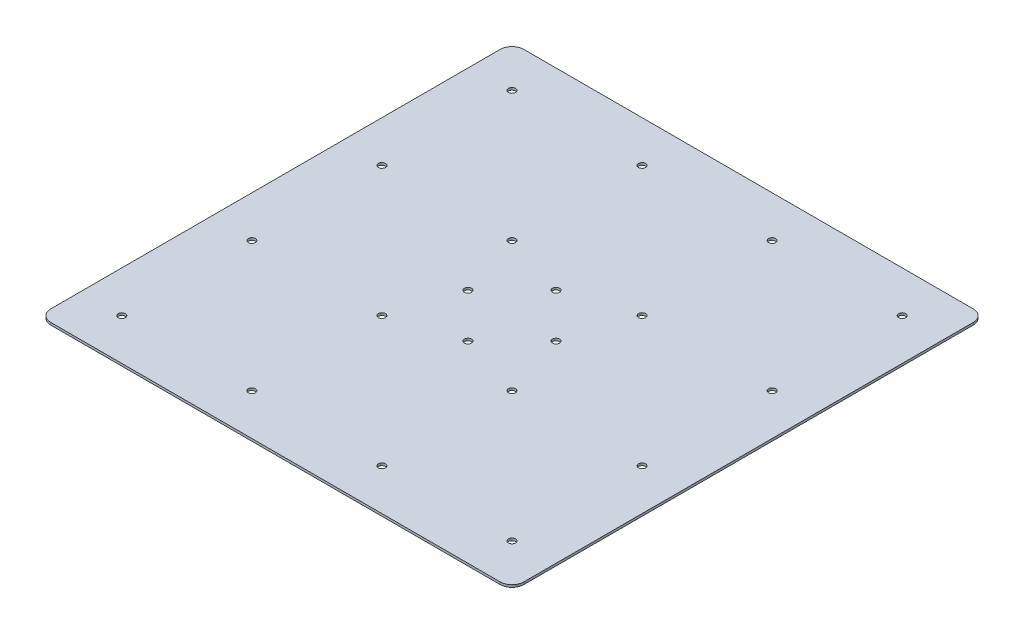
from build123d import *

# Parameters (mm, degrees)
SKETCH1_W           = 400
SKETCH1_H           = 400
BOSS_EXTRUDE1_DEPTH = 2
SKETCH3_R           = 3
CUT_EXTRUDE1_DEPTH  = 283.849783454
SKETCH4_R           = 3
CUT_EXTRUDE2_DEPTH  = 283.849783454
FILLET1_R           = 10


with BuildPart() as part:
    # Sketch1 → Boss-Extrude1 (new body)
    with BuildSketch(Plane(origin=(0, 0, 0), x_dir=(1, 0, 0), z_dir=(0, 1, 0))):
        Rectangle(SKETCH1_W, SKETCH1_H)
    extrude(amount=BOSS_EXTRUDE1_DEPTH)

    # Sketch3 → Cut-Extrude1 (cut, through all)
    with BuildSketch(Plane(origin=(0, 2, 0), x_dir=(1, 0, 0), z_dir=(0, 1, 0))):
        with Locations(Location((-37.25, 0, 0), (0, 0, 270))):
            Circle(SKETCH3_R)
        with Locations(Location((0, 37.25, 0), (0, 0, 270))):
            Circle(SKETCH3_R)
        with Locations(Location((37.25, 0, 0), (0, 0, 270))):
            Circle(SKETCH3_R)
        with Locations(Location((0, -37.25, 0), (0, 0, 270))):
            Circle(SKETCH3_R)
    extrude(amount=-CUT_EXTRUDE1_DEPTH, mode=Mode.SUBTRACT)

    # Sketch4 → Cut-Extrude2 (cut, through all)
    with BuildSketch(Plane(origin=(0, 2, 0), x_dir=(1, 0, 0), z_dir=(0, 1, 0))):
        with Locations(Location((-165, 165, 0), (0, 0, 270))):
            Circle(SKETCH4_R)
        with Locations(Location((-55, 165, 0), (0, 0, 270))):
            Circle(SKETCH4_R)
        with Locations(Location((55, 165, 0), (0, 0, 270))):
            Circle(SKETCH4_R)
        with Locations(Location((165, 165, 0), (0, 0, 270))):
            Circle(SKETCH4_R)
        with Locations(Location((-55, 55, 0), (0, 0, 270))):
            Circle(SKETCH4_R)
        with Locations(Location((55, 55, 0), (0, 0, 270))):
            Circle(SKETCH4_R)
        with Locations(Location((165, 55, 0), (0, 0, 270))):
            Circle(SKETCH4_R)
        with Locations(Location((-55, -55, 0), (0, 0, 270))):
            Circle(SKETCH4_R)
        with Locations(Location((55, -55, 0), (0, 0, 270))):
            Circle(SKETCH4_R)
        with Locations(Location((165, -55, 0), (0, 0, 270))):
            Circle(SKETCH4_R)
        with Locations(Location((-55, -165, 0), (0, 0, 270))):
            Circle(SKETCH4_R)
        with Locations(Location((55, -165, 0), (0, 0, 270))):
            Circle(SKETCH4_R)
        with Locations(Location((165, -165, 0), (0, 0, 270))):
            Circle(SKETCH4_R)
        with Locations(Location((-165, 55, 0), (0, 0, 270))):
            Circle(SKETCH4_R)
        with Locations(Location((-165, -55, 0), (0, 0, 270))):
            Circle(SKETCH4_R)
        with Locations(Location((-165, -165, 0), (0, 0, 270))):
            Circle(SKETCH4_R)
    extrude(amount=-CUT_EXTRUDE2_DEPTH, mode=Mode.SUBTRACT)

    # Fillet1
    fillet1_edges = [part.edges().sort_by_distance(p)[0] for p in [
        (200, 1, 200),
        (-200, 1, 200),
        (-200, 1, -200),
        (200, 1, -200),
    ]]
    fillet(fillet1_edges, radius=FILLET1_R)


solid = part.part
